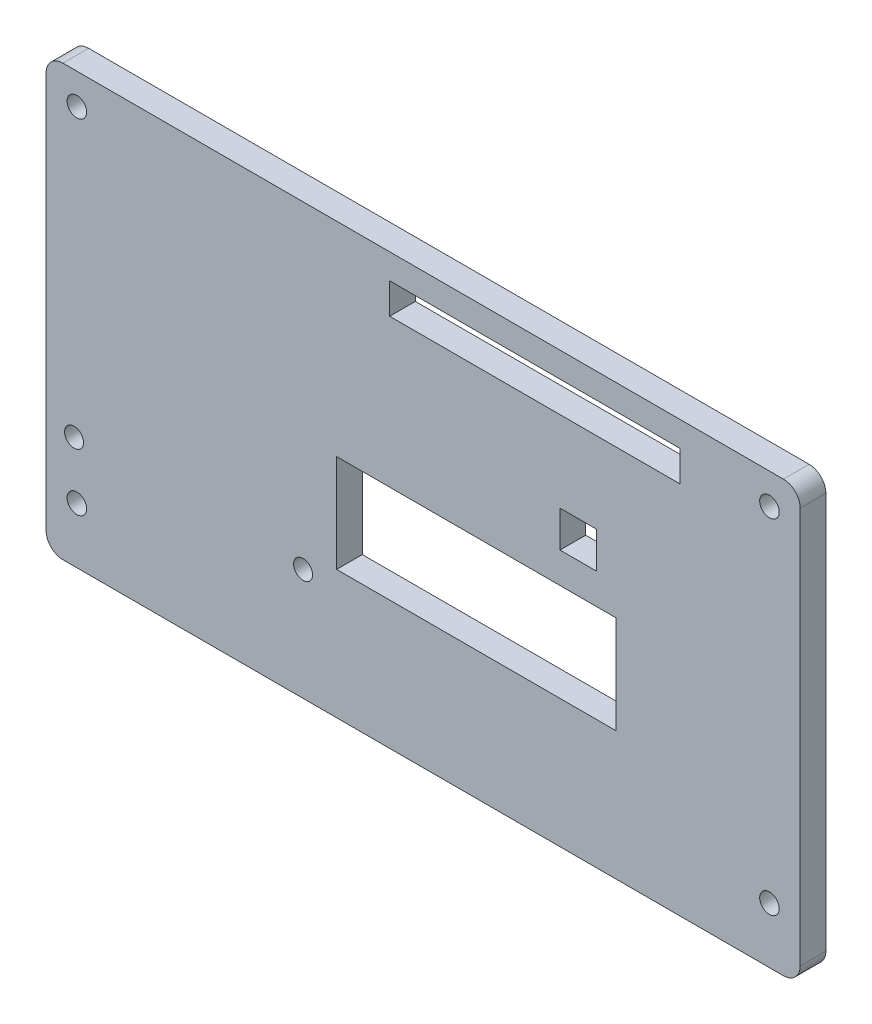
from build123d import *

# Parameters (mm, degrees)
SKETCH1_R          = 1.75
SKETCH1_W          = 52
SKETCH1_H          = 5.5
SKETCH1_W_2        = 50
SKETCH1_H_2        = 17.5
SKETCH1_W_3        = 6.5
SKETCH1_H_3        = 6.5
EXTRUDE1_DEPTH     = 4.6
SKETCH2_R          = 1.7
CUT_EXTRUDE1_DEPTH = 163.26527615


with BuildPart() as part:
    # Sketch1 → Extrude1 (new body)
    with BuildSketch(Plane.XY):
        with BuildLine():
            Line((7.924813653, 82.036006536), (136.924813653, 82.036006536))
            ThreePointArc((136.924813653, 82.036006536), (139.046133996, 81.15732688), (139.924813653, 79.036006536))
            Line((139.924813653, 79.036006536), (139.924813653, 8.036006536))
            ThreePointArc((139.924813653, 8.036006536), (139.046133996, 5.914686193), (136.924813653, 5.036006536))
            Line((136.924813653, 5.036006536), (7.924813653, 5.036006536))
            ThreePointArc((7.924813653, 5.036006536), (5.803493309, 5.914686193), (4.924813653, 8.036006536))
            Line((4.924813653, 8.036006536), (4.924813653, 79.036006536))
            ThreePointArc((4.924813653, 79.036006536), (5.803493309, 81.15732688), (7.924813653, 82.036006536))
        make_face()
        with Locations((134.424813653, 76.536006536)):
            Circle(SKETCH1_R, mode=Mode.SUBTRACT)
        with Locations((10.424813653, 76.536006536)):
            Circle(SKETCH1_R, mode=Mode.SUBTRACT)
        with Locations((10.424813653, 15.036006536)):
            Circle(SKETCH1_R, mode=Mode.SUBTRACT)
        with Locations((134.424813653, 15.036006536)):
            Circle(SKETCH1_R, mode=Mode.SUBTRACT)
        with Locations((92.424813653, 74.786006536)):
            Rectangle(SKETCH1_W, SKETCH1_H, mode=Mode.SUBTRACT)
        with Locations((81.924813653, 36.786006536)):
            Rectangle(SKETCH1_W_2, SKETCH1_H_2, mode=Mode.SUBTRACT)
        with Locations((100.174813653, 54.286006536)):
            Rectangle(SKETCH1_W_3, SKETCH1_H_3, mode=Mode.SUBTRACT)
    extrude(amount=EXTRUDE1_DEPTH)

    # Sketch2 → Cut-Extrude1 (cut, through all)
    with BuildSketch(Plane(origin=(0, 0, 0), x_dir=(-1, 0, 0), z_dir=(0, 0, -1))):
        with Locations((-50.924813653, 25.036006536)):
            Circle(SKETCH2_R)
        with Locations((-9.924813653, 25.036006536)):
            Circle(SKETCH2_R)
    extrude(amount=-CUT_EXTRUDE1_DEPTH, mode=Mode.SUBTRACT)


solid = part.part
